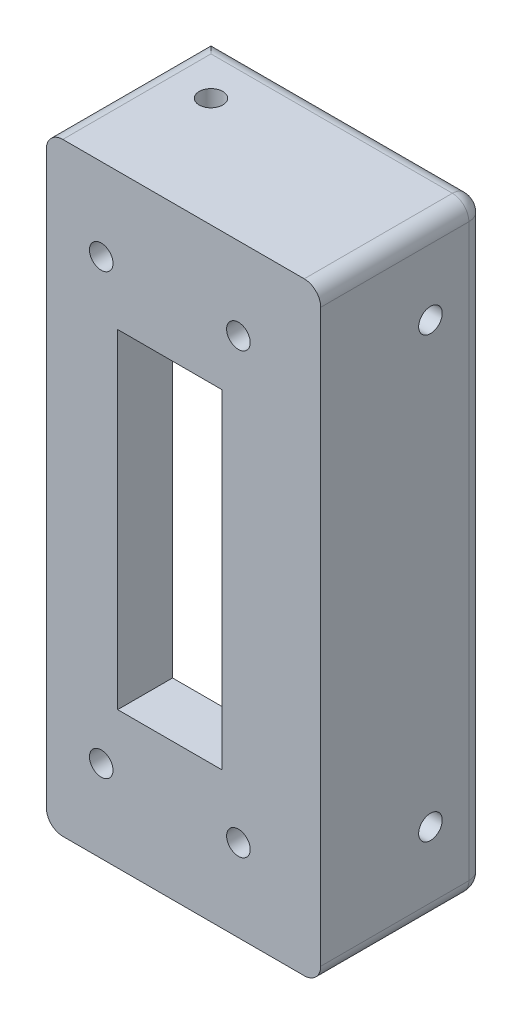
from build123d import *

# Parameters (mm, degrees)
SKIZZE1_W                       = 19
SKIZZE1_H                       = 60
SKIZZE1_R                       = 2.15
AUFSATZ_LINEAR_AUSTRAGEN2_DEPTH = 10
SKIZZE3_W                       = 45
SKIZZE3_H                       = 5
AUFSATZ_LINEAR_AUSTRAGEN3_DEPTH = 20
SKIZZE4_R                       = 2.15
SCHNITT_LINEAR_AUSTRAGEN1_DEPTH = 20
SKIZZE5_R                       = 2.15
SCHNITT_LINEAR_AUSTRAGEN2_DEPTH = 120
VERRUNDUNG1_R                   = 3


with BuildPart() as part:
    # Skizze1 → Aufsatz-Linear austragen2 (new body)
    with BuildSketch(Plane.XY):
        Polygon((0, -5), (50, -5), (50, 105), (0, 105), (0, 90), (0, 10), align=None)
        with Locations((22.5, 50)):
            Rectangle(SKIZZE1_W, SKIZZE1_H, mode=Mode.SUBTRACT)
        with Locations((35, 10)):
            Circle(SKIZZE1_R, mode=Mode.SUBTRACT)
        with Locations((10, 10)):
            Circle(SKIZZE1_R, mode=Mode.SUBTRACT)
        with Locations((35, 90)):
            Circle(SKIZZE1_R, mode=Mode.SUBTRACT)
        with Locations((10, 90)):
            Circle(SKIZZE1_R, mode=Mode.SUBTRACT)
    extrude(amount=AUFSATZ_LINEAR_AUSTRAGEN2_DEPTH)

    # Skizze3 → Aufsatz-Linear austragen3 (add)
    with BuildSketch(Plane(origin=(0, 0, 0), x_dir=(-1, 0, 0), z_dir=(0, 0, -1))):
        Polygon((-45, 105), (-50, 105), (-50, -5), (-45, -5), (-45, 0), (-45, 100), align=None)
        with Locations((-22.5, 102.5)):
            Rectangle(SKIZZE3_W, SKIZZE3_H)
        with Locations((-22.5, -2.5)):
            Rectangle(SKIZZE3_W, SKIZZE3_H)
    extrude(amount=AUFSATZ_LINEAR_AUSTRAGEN3_DEPTH)

    # Skizze4 → Schnitt-Linear austragen1 (cut)
    with BuildSketch(Plane.ZY.offset(-45)):
        with Locations((-10, 90)):
            Circle(SKIZZE4_R)
        with Locations((-10, 10)):
            Circle(SKIZZE4_R)
    extrude(amount=-SCHNITT_LINEAR_AUSTRAGEN1_DEPTH, mode=Mode.SUBTRACT)

    # Skizze5 → Schnitt-Linear austragen2 (cut)
    with BuildSketch(Plane(origin=(0, 105, 0), x_dir=(1, 0, 0), z_dir=(0, 1, 0))):
        with Locations((10, 10)):
            Circle(SKIZZE5_R)
    extrude(amount=-SCHNITT_LINEAR_AUSTRAGEN2_DEPTH, mode=Mode.SUBTRACT)

    # Verrundung1
    verrundung1_edges = [part.edges().sort_by_distance(p)[0] for p in [
        (50, 105, -5),
        (50, -5, -5),
        (0, -5, -5),
        (0, 105, -5),
        (25, 105, -20),
        (50, 50, -20),
        (25, -5, -20),
    ]]
    fillet(verrundung1_edges, radius=VERRUNDUNG1_R)


solid = part.part
